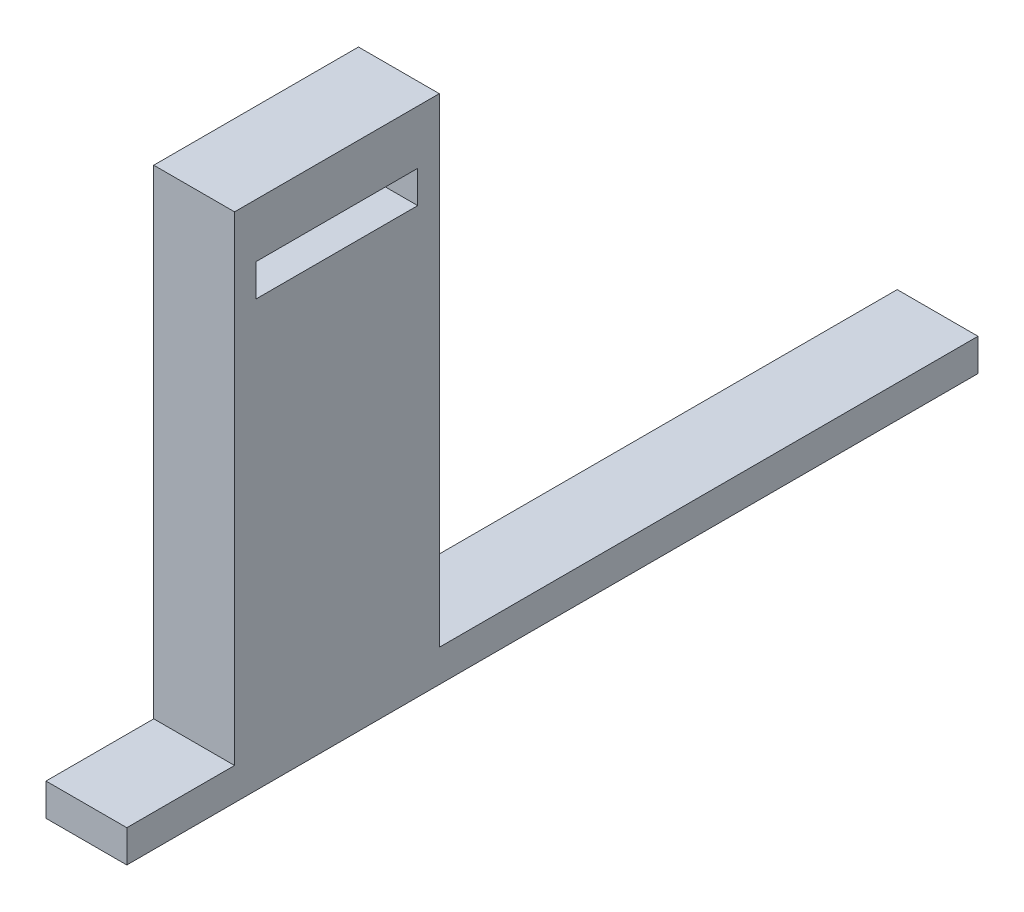
from build123d import *

# Parameters (mm, degrees)
SKETCH1_W           = 30
SKETCH1_H           = 6
BOSS_EXTRUDE1_DEPTH = 15


with BuildPart() as part:
    # Sketch1 → Boss-Extrude1 (new body)
    with BuildSketch(Plane(origin=(0, 0, 0), x_dir=(0, 0, -1), z_dir=(1, 0, 0))):
        Polygon((-79, 0), (79, 0), (79, 6), (-21, 6), (-21, 95), (-59, 95), (-59, 6), (-79, 6), align=None)
        with Locations((-40, 82)):
            Rectangle(SKETCH1_W, SKETCH1_H, mode=Mode.SUBTRACT)
    extrude(amount=BOSS_EXTRUDE1_DEPTH)


solid = part.part
